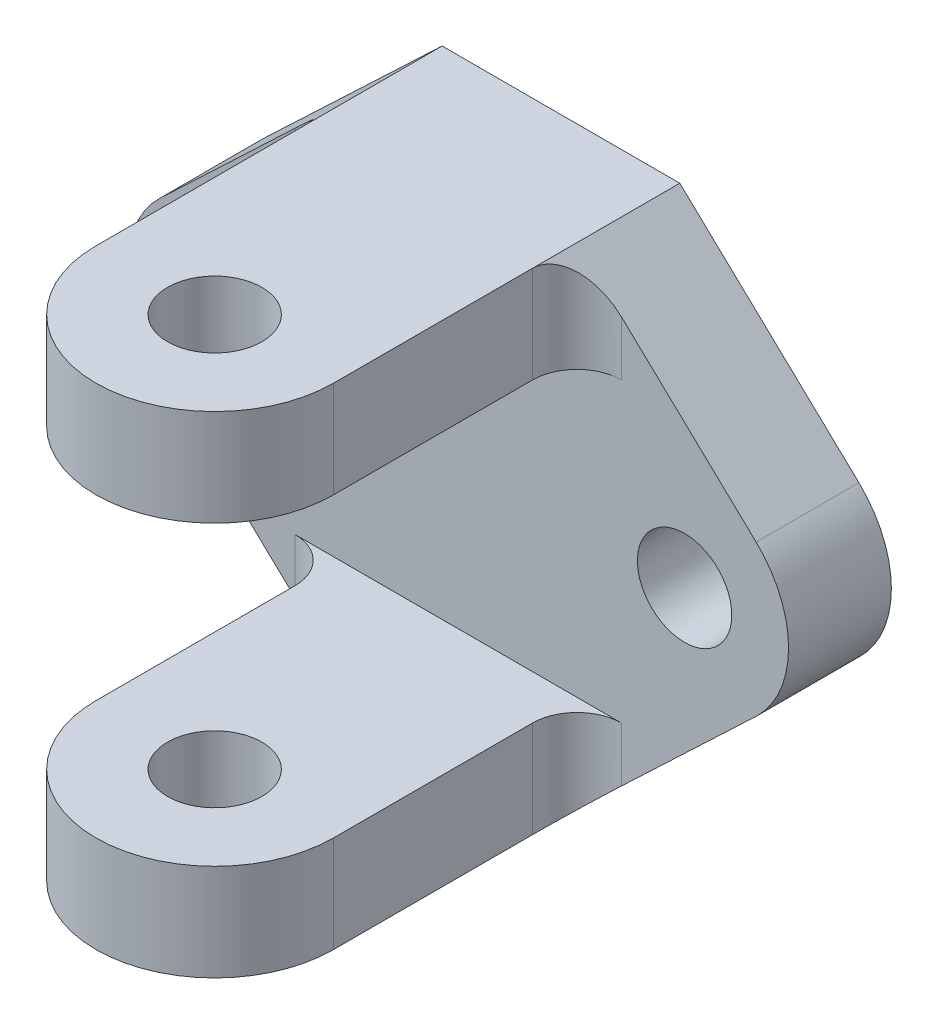
from build123d import *

# Parameters (mm, degrees)
SKETCH1_W                      = 46.48
SKETCH1_H                      = 33.02
SKETCH1_R                      = 3.175
BOSS_EXTRUDE1_DEPTH            = 9.46
SKETCH2_W                      = 46.48
SKETCH2_H                      = 6.51
BOSS_EXTRUDE2_DEPTH            = 35.982
CUT_EXTRUDE1_REACH             = 55.644
SKETCH4_R                      = 3.175
CUT_EXTRUDE1_DIRECTION_2_REACH = 55.644
CUT_EXTRUDE3_REACH             = 55.644
CUT_EXTRUDE3_DIRECTION_2_REACH = 55.644
CUT_EXTRUDE4_DEPTH             = 9.46
BOSS_EXTRUDE3_DEPTH            = 9.46
FILLET3_R                      = 3
CUT_EXTRUDE5_DEPTH             = 2.54


with BuildPart() as part:
    # Sketch1 → Boss-Extrude1 (new body)
    with BuildSketch(Plane.XY):
        Rectangle(SKETCH1_W, SKETCH1_H)
        with Locations((15.24, 0)):
            Circle(SKETCH1_R, mode=Mode.SUBTRACT)
        with Locations((-15.24, 0)):
            Circle(SKETCH1_R, mode=Mode.SUBTRACT)
    extrude(amount=BOSS_EXTRUDE1_DEPTH)

    # Sketch2 → Boss-Extrude2 (add)
    with BuildSketch(Plane.XY.offset(9.46)):
        with Locations((0, 13.255)):
            Rectangle(SKETCH2_W, SKETCH2_H)
        with Locations((0, -13.255)):
            Rectangle(SKETCH2_W, SKETCH2_H)
    extrude(amount=BOSS_EXTRUDE2_DEPTH)

    # Cut-Extrude1: up to this face of the body (flat: up to its plane)
    cut_extrude1_end = Plane(part.part.faces().sort_by_distance((0, -16.51, 22.721))[0])
    # Sketch4 → Cut-Extrude1 (cut, up to the picked face)
    with BuildSketch(Plane(origin=(0, 0, 0), x_dir=(1, 0, 0), z_dir=(0, 1, 0)), mode=Mode.PRIVATE) as cut_extrude1_sk1:
        with Locations(Location((0, -25.8481308, 0), (0, 0, 270))):
            Circle(SKETCH4_R)
    cut_extrude1_tool1 = split(extrude(cut_extrude1_sk1.sketch, amount=-CUT_EXTRUDE1_REACH, mode=Mode.PRIVATE), bisect_by=cut_extrude1_end, keep=Keep.BOTH, mode=Mode.PRIVATE)
    add(cut_extrude1_tool1.solids().sort_by(Axis((0, 0, 25.848131), (0, -1, 0)))[0], mode=Mode.SUBTRACT)

    # Cut-Extrude1 direction 2: up to this face of the body (flat: up to its plane)
    cut_extrude1_direction_2_end = Plane(part.part.faces().sort_by_distance((0, 16.51, 22.721))[0])
    # Sketch4 → Cut-Extrude1 direction 2 (cut, up to the picked face)
    with BuildSketch(Plane(origin=(0, 0, 0), x_dir=(1, 0, 0), z_dir=(0, 1, 0)), mode=Mode.PRIVATE) as cut_extrude1_direction_2_sk1:
        with Locations(Location((0, -25.8481308, 0), (0, 0, 270))):
            Circle(SKETCH4_R)
    cut_extrude1_direction_2_tool1 = split(extrude(cut_extrude1_direction_2_sk1.sketch, amount=CUT_EXTRUDE1_DIRECTION_2_REACH, mode=Mode.PRIVATE), bisect_by=cut_extrude1_direction_2_end, keep=Keep.BOTH, mode=Mode.PRIVATE)
    add(cut_extrude1_direction_2_tool1.solids().sort_by(Axis((0, 0, 25.848131), (0, 1, 0)))[0], mode=Mode.SUBTRACT)

    # Cut-Extrude3: up to this face of the body (flat: up to its plane)
    cut_extrude3_end = Plane(part.part.faces().sort_by_distance((-22.589971865, -16.51, 22.721))[0])
    # Sketch6 → Cut-Extrude3 (cut, up to the picked face)
    with BuildSketch(Plane(origin=(0, 0, 0), x_dir=(1, 0, 0), z_dir=(0, 1, 0)), mode=Mode.PRIVATE) as cut_extrude3_sk1:
        with BuildLine():
            Line((-8, -25.8481308), (-8, -17.46))
            Line((-8, -17.46), (-8, -9.46))
            Line((-8, -9.46), (-16, -9.46))
            Line((-16, -9.46), (-23.24, -9.46))
            Line((-23.24, -9.46), (-23.24, -45.442))
            Line((-23.24, -45.442), (23.24, -45.442))
            Line((23.24, -45.442), (23.24, -9.46))
            Line((23.24, -9.46), (16, -9.46))
            Line((16, -9.46), (8, -9.46))
            Line((8, -9.46), (8, -17.46))
            Line((8, -17.46), (8, -25.8481308))
            ThreePointArc((8, -25.8481308), (0, -33.8481308), (-8, -25.8481308))
        make_face()
    cut_extrude3_tool1 = split(extrude(cut_extrude3_sk1.sketch, amount=-CUT_EXTRUDE3_REACH, mode=Mode.PRIVATE), bisect_by=cut_extrude3_end, keep=Keep.BOTH, mode=Mode.PRIVATE)
    add(cut_extrude3_tool1.solids().sort_by(Axis((-8.587801, 0, 21.654065), (0, -1, 0)))[0], mode=Mode.SUBTRACT)

    # Cut-Extrude3 direction 2: up to this face of the body (flat: up to its plane)
    cut_extrude3_direction_2_end = Plane(part.part.faces().sort_by_distance((22.589971865, 16.51, 22.721))[0])
    # Sketch6 → Cut-Extrude3 direction 2 (cut, up to the picked face)
    with BuildSketch(Plane(origin=(0, 0, 0), x_dir=(1, 0, 0), z_dir=(0, 1, 0)), mode=Mode.PRIVATE) as cut_extrude3_direction_2_sk1:
        with BuildLine():
            Line((-8, -25.8481308), (-8, -17.46))
            Line((-8, -17.46), (-8, -9.46))
            Line((-8, -9.46), (-16, -9.46))
            Line((-16, -9.46), (-23.24, -9.46))
            Line((-23.24, -9.46), (-23.24, -45.442))
            Line((-23.24, -45.442), (23.24, -45.442))
            Line((23.24, -45.442), (23.24, -9.46))
            Line((23.24, -9.46), (16, -9.46))
            Line((16, -9.46), (8, -9.46))
            Line((8, -9.46), (8, -17.46))
            Line((8, -17.46), (8, -25.8481308))
            ThreePointArc((8, -25.8481308), (0, -33.8481308), (-8, -25.8481308))
        make_face()
    cut_extrude3_direction_2_tool1 = split(extrude(cut_extrude3_direction_2_sk1.sketch, amount=CUT_EXTRUDE3_DIRECTION_2_REACH, mode=Mode.PRIVATE), bisect_by=cut_extrude3_direction_2_end, keep=Keep.BOTH, mode=Mode.PRIVATE)
    add(cut_extrude3_direction_2_tool1.solids().sort_by(Axis((-8.587801, 0, 21.654065), (0, 1, 0)))[0], mode=Mode.SUBTRACT)

    # Sketch7 → Cut-Extrude4 (cut)
    with BuildSketch(Plane.XY):
        with BuildLine():
            ThreePointArc((-15.24, -7), (-22.24, 0), (-15.24, 7))
            Line((-15.24, 7), (-8, 7))
            Line((-8, 7), (-8, 16.51))
            Line((-8, 16.51), (-23.24, 16.51))
            Line((-23.24, 16.51), (-23.24, -16.51))
            Line((-23.24, -16.51), (-8, -16.51))
            Line((-8, -16.51), (-8, -7))
            Line((-8, -7), (-15.24, -7))
        make_face()
        with BuildLine():
            Line((8, 16.51), (8, 7))
            Line((8, 7), (15.24, 7))
            ThreePointArc((15.24, 7), (22.24, 0), (15.24, -7))
            Line((15.24, -7), (8, -7))
            Line((8, -7), (8, -16.51))
            Line((8, -16.51), (23.24, -16.51))
            Line((23.24, -16.51), (23.24, 16.51))
            Line((23.24, 16.51), (8, 16.51))
        make_face()
    extrude(amount=CUT_EXTRUDE4_DEPTH, mode=Mode.SUBTRACT)

    # Sketch8 → Boss-Extrude3 (add)
    with BuildSketch(Plane.XY):
        with BuildLine():
            Line((8, -16.51), (20.056111128, -5.079869447))
            ThreePointArc((20.056111128, -5.079869447), (17.832384411, -6.502272146), (15.24, -7))
            Line((15.24, -7), (8, -7))
            Line((8, -7), (8, -16.51))
        make_face()
        with BuildLine():
            ThreePointArc((-20.056111128, -5.079869447), (-17.832384411, -6.502272146), (-15.24, -7))
            Line((-15.24, -7), (-8, -7))
            Line((-8, -7), (-8, -16.51))
            Line((-8, -16.51), (-20.056111128, -5.079869447))
        make_face()
        with BuildLine():
            Line((8, 16.51), (20.056111128, 5.079869447))
            ThreePointArc((20.056111128, 5.079869447), (17.832384411, 6.502272146), (15.24, 7))
            Line((15.24, 7), (8, 7))
            Line((8, 7), (8, 16.51))
        make_face()
        with BuildLine():
            Line((-8, 16.51), (-20.056111128, 5.079869447))
            ThreePointArc((-20.056111128, 5.079869447), (-17.832384411, 6.502272146), (-15.24, 7))
            Line((-15.24, 7), (-8, 7))
            Line((-8, 7), (-8, 16.51))
        make_face()
    extrude(amount=BOSS_EXTRUDE3_DEPTH)

    # Fillet3
    fillet3_edges = [part.edges().sort_by_distance(p)[0] for p in [
        (8, -13.255, 9.46),
        (-8, -13.255, 9.46),
        (8, 13.255, 9.46),
        (-8, 13.255, 9.46),
    ]]
    fillet(fillet3_edges, radius=FILLET3_R)

    # Sketch10 → Cut-Extrude5 (cut)
    with BuildSketch(Plane.XY):
        with BuildLine():
            Line((-8, 16.51), (-20.056111128, 5.079869447))
            ThreePointArc((-20.056111128, 5.079869447), (-22.24, 0), (-20.056111128, -5.079869447))
            Line((-20.056111128, -5.079869447), (-8, -16.51))
            Line((-8, -16.51), (8, -16.51))
            Line((8, -16.51), (20.056111128, -5.079869447))
            ThreePointArc((20.056111128, -5.079869447), (22.24, 0), (20.056111128, 5.079869447))
            Line((20.056111128, 5.079869447), (8, 16.51))
            Line((8, 16.51), (-8, 16.51))
        make_face()
    extrude(amount=CUT_EXTRUDE5_DEPTH, mode=Mode.SUBTRACT)


solid = part.part
